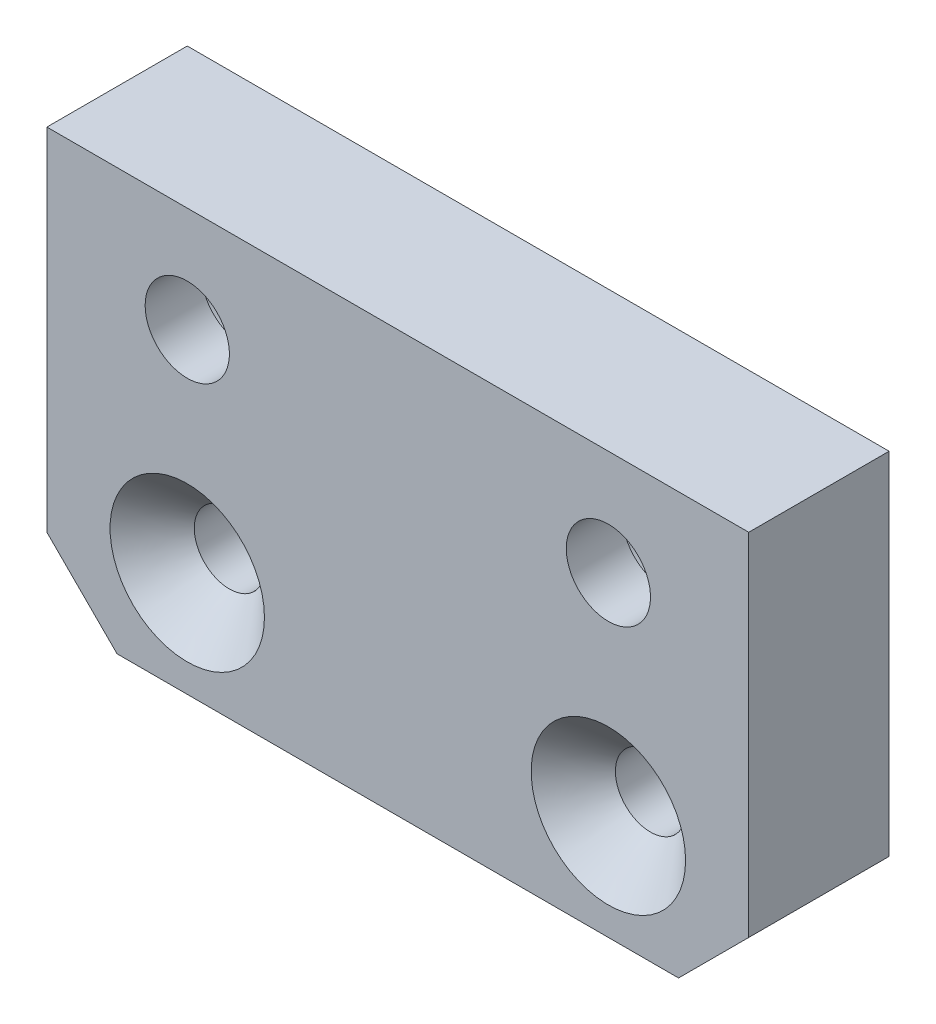
from build123d import *

# Parameters (mm, degrees)
ESQUISSE1_W          = 50
ESQUISSE1_H          = 30
BASE_EXTRUSION_DEPTH = 10
PER_AGE1_D           = 5
PER_AGE1_CSINK_D     = 11
PER_AGE1_CSINK_ANGLE = 90
PER_AGE2_D           = 6
PER_AGE2_CBORE_D     = 11
PER_AGE2_CBORE_DEPTH = 6
CHANFREIN1_SIZE      = 5


with BuildPart() as part:
    # Esquisse1 → Base-Extrusion (new body)
    with BuildSketch(Plane.XY):
        with Locations((0, 15)):
            Rectangle(ESQUISSE1_W, ESQUISSE1_H)
    extrude(amount=BASE_EXTRUSION_DEPTH)

    # Perçage1 (through all)
    with Locations(Plane.XY.offset(10)):
        with Locations((15, 7.5)):
            per_age1 = CounterSinkHole(PER_AGE1_D / 2, PER_AGE1_CSINK_D / 2, counter_sink_angle=PER_AGE1_CSINK_ANGLE)

    # Symétrie1: Perçage1 across plane
    add(per_age1.mirror(Plane(origin=(0, 0, 0), x_dir=(0, 0, 1), z_dir=(1, 0, 0))), mode=Mode.SUBTRACT)

    # Perçage2 (through all)
    with Locations(Plane(origin=(0, 0, 0), x_dir=(-1, 0, 0), z_dir=(0, 0, -1))):
        with Locations((-15, 22.5)):
            per_age2 = CounterBoreHole(PER_AGE2_D / 2, PER_AGE2_CBORE_D / 2, PER_AGE2_CBORE_DEPTH)

    # Symétrie2: Perçage2 across plane
    add(per_age2.mirror(Plane(origin=(0, 0, 0), x_dir=(0, 0, 1), z_dir=(1, 0, 0))), mode=Mode.SUBTRACT)

    # Chanfrein1
    chanfrein1_edges = [part.edges().sort_by_distance(p)[0] for p in [
        (-25, 0, 5),
        (25, 0, 5),
    ]]
    chamfer(chanfrein1_edges, length=CHANFREIN1_SIZE)


solid = part.part
